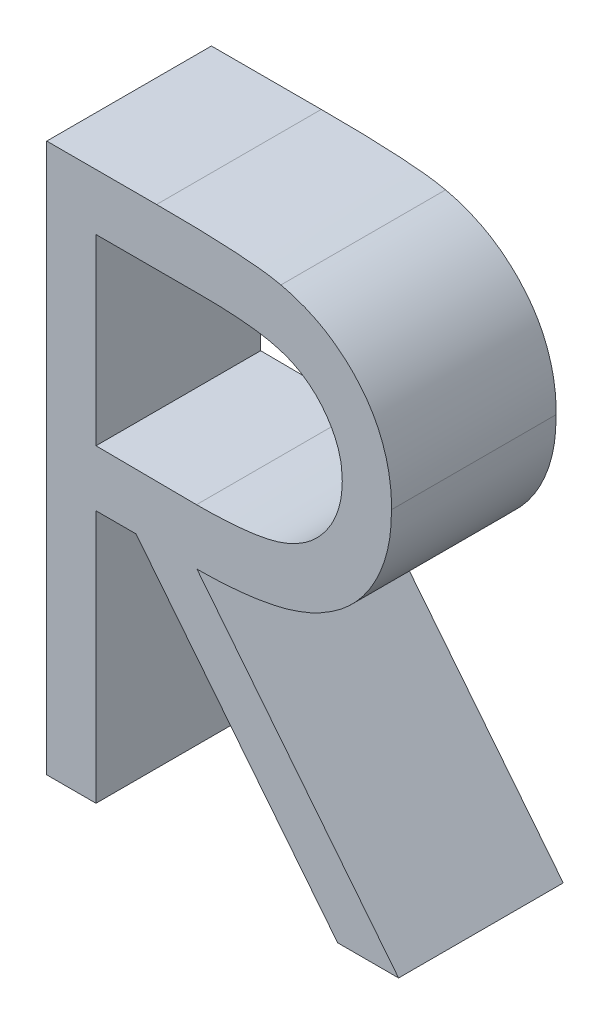
from build123d import *

# Parameters (mm, degrees)
BOSS_EXTRU_1_DEPTH = 1.5


with BuildPart() as part:
    # Esquisse1 → Boss.-Extru.1 (new body)
    with BuildSketch(Plane.XY):
        with BuildLine():
            Line((-55.432465326, -17.870119076), (-54.431864364, -17.870119076))
            add(Edge.make_bspline(
                [(-54.431864364, -17.870119076), (-54.365091324, -17.870341342), (-54.236879689, -17.870768117), (-54.053203588, -17.873147778), (-53.886307735, -17.879968286), (-53.736279393, -17.885837691), (-53.603121315, -17.896540464), (-53.486425185, -17.90676996), (-53.386728475, -17.920160904), (-53.326377258, -17.932597223), (-53.299051864, -17.938228051)],
                knots=[0, 0, 0, 0, 1.410062039, 2.707475311, 3.878576406, 4.937260626, 5.877586885, 6.699081471, 7.410979367, 8, 8, 8, 8], degree=3))
            add(Edge.make_bspline(
                [(-53.299051864, -17.938228051), (-53.262470973, -17.947266287), (-53.190089559, -17.965149949), (-53.085875179, -18.002949379), (-52.986569002, -18.0466917), (-52.892583539, -18.098068443), (-52.804389551, -18.157460986), (-52.721077679, -18.223844018), (-52.642269874, -18.296854312), (-52.571153259, -18.378332657), (-52.504097471, -18.463813385), (-52.447542291, -18.556247323), (-52.398790177, -18.652906648), (-52.359975152, -18.754774388), (-52.328720905, -18.860862633), (-52.30668342, -18.972132343), (-52.293467437, -19.088076593), (-52.292121929, -19.16715932), (-52.291439685, -19.207258499)],
                knots=[0, 0, 0, 0, 1.027469482, 2.033020251, 3.019912614, 3.986113645, 4.951240523, 5.91722682, 6.890402269, 7.87763091, 8.8651537, 9.85103654, 10.82876324, 11.815024772, 12.821070561, 13.842952187, 14.906261191, 16, 16, 16, 16], degree=3))
            add(Edge.make_bspline(
                [(-52.291439685, -19.207258499), (-52.293538254, -19.273880077), (-52.297633105, -19.403876031), (-52.335811824, -19.592534433), (-52.39834971, -19.768519169), (-52.484525837, -19.931608651), (-52.594267945, -20.078623859), (-52.726160504, -20.207753081), (-52.880277091, -20.315810099), (-53.023747543, -20.390742677), (-53.150482114, -20.438732547), (-53.254815418, -20.472498773), (-53.368625386, -20.498587295), (-53.490821578, -20.521958912), (-53.621912514, -20.53960419), (-53.761583999, -20.552527896), (-53.909935644, -20.560605109), (-54.011848601, -20.561807973), (-54.064276223, -20.562426769)],
                knots=[0, 0, 0, 0, 1.260483769, 2.459530307, 3.627416485, 4.787058657, 5.939039949, 7.08810263, 8.267026773, 9.491475466, 10.141966685, 10.831826277, 11.566392101, 12.351337768, 13.187381173, 14.07005841, 15.007169909, 16, 16, 16, 16], degree=3))
            Line((-54.064276223, -20.562426769), (-52.227337121, -22.870119076))
            Line((-52.227337121, -22.870119076), (-52.782224941, -22.870119076))
            Line((-52.782224941, -22.870119076), (-54.619164044, -20.562426769))
            Line((-54.619164044, -20.562426769), (-54.983747377, -20.562426769))
            Line((-54.983747377, -20.562426769), (-54.983747377, -22.870119076))
            Line((-54.983747377, -22.870119076), (-55.432465326, -22.870119076))
            Line((-55.432465326, -22.870119076), (-55.432465326, -17.870119076))
        make_face()
        with BuildLine():
            Line((-54.983747377, -18.382939589), (-54.983747377, -20.049606256))
            Line((-54.983747377, -20.049606256), (-54.068282634, -20.056617474))
            add(Edge.make_bspline(
                [(-54.068282634, -20.056617474), (-54.025539721, -20.056636383), (-53.942691782, -20.056673035), (-53.822833689, -20.050967641), (-53.71123353, -20.044477186), (-53.60831817, -20.034549549), (-53.514041634, -20.021755161), (-53.428451043, -20.005750898), (-53.351406683, -19.987105094), (-53.261551628, -19.958245629), (-53.161213727, -19.912522746), (-53.052168784, -19.846000605), (-52.959308301, -19.762330434), (-52.880854212, -19.666654069), (-52.817812167, -19.561459427), (-52.773366375, -19.448007471), (-52.745162886, -19.329162331), (-52.741836393, -19.24747932), (-52.740157634, -19.206256897)],
                knots=[0, 0, 0, 0, 1.146690395, 2.22261258, 3.21895312, 4.145990853, 4.996080663, 5.770904154, 6.481378293, 7.121626537, 8.300444488, 9.431385265, 10.535395872, 11.636531494, 12.74115979, 13.810798291, 14.895190096, 16, 16, 16, 16], degree=3))
            add(Edge.make_bspline(
                [(-52.740157634, -19.206256897), (-52.741874949, -19.166047506), (-52.745278043, -19.086367165), (-52.773061998, -18.969715864), (-52.820046828, -18.859620221), (-52.883364311, -18.7565281), (-52.960505961, -18.662948477), (-53.050959979, -18.582881116), (-53.152253115, -18.516810452), (-53.246926256, -18.474589908), (-53.331546559, -18.448704404), (-53.405017502, -18.430488455), (-53.488033899, -18.4158535), (-53.58099884, -18.404127698), (-53.683515455, -18.394049207), (-53.796102099, -18.387260951), (-53.918011786, -18.383241146), (-54.002507402, -18.383042447), (-54.046247377, -18.382939589)],
                knots=[0, 0, 0, 0, 1.101028733, 2.181837193, 3.264309656, 4.369019818, 5.486613113, 6.575447106, 7.666700264, 8.788928104, 9.402425223, 10.0903467, 10.862060571, 11.710948788, 12.657782767, 13.684531032, 14.801375019, 16, 16, 16, 16], degree=3))
            Line((-54.046247377, -18.382939589), (-54.983747377, -18.382939589))
        make_face(mode=Mode.SUBTRACT)
    extrude(amount=BOSS_EXTRU_1_DEPTH)


solid = part.part
